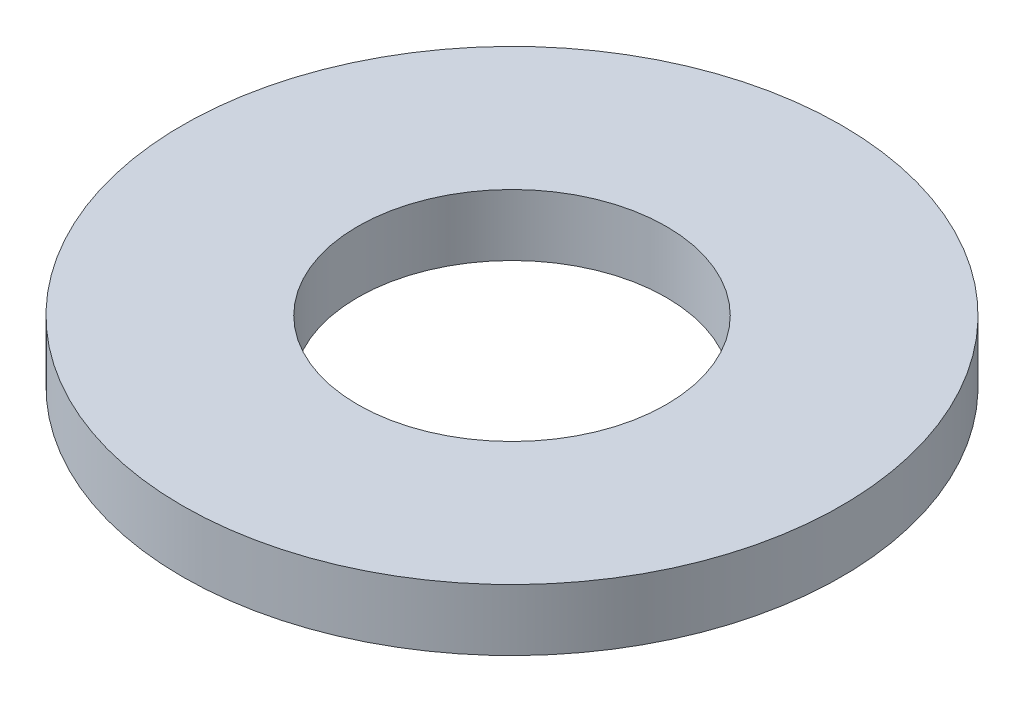
from build123d import *

# Parameters (mm, degrees)
SKETCH1_R           = 7.62
SKETCH1_R_2         = 3.5687
BOSS_EXTRUDE1_DEPTH = 1.4224


with BuildPart() as part:
    # Sketch1 → Boss-Extrude1 (new body)
    with BuildSketch(Plane(origin=(0, 0, 0), x_dir=(1, 0, 0), z_dir=(0, 1, 0))):
        with Locations(Location((0, 0, 0), (0, 0, 270))):
            Circle(SKETCH1_R)
        with Locations(Location((0, 0, 0), (0, 0, 270))):
            Circle(SKETCH1_R_2, mode=Mode.SUBTRACT)
    extrude(amount=BOSS_EXTRUDE1_DEPTH)


solid = part.part
